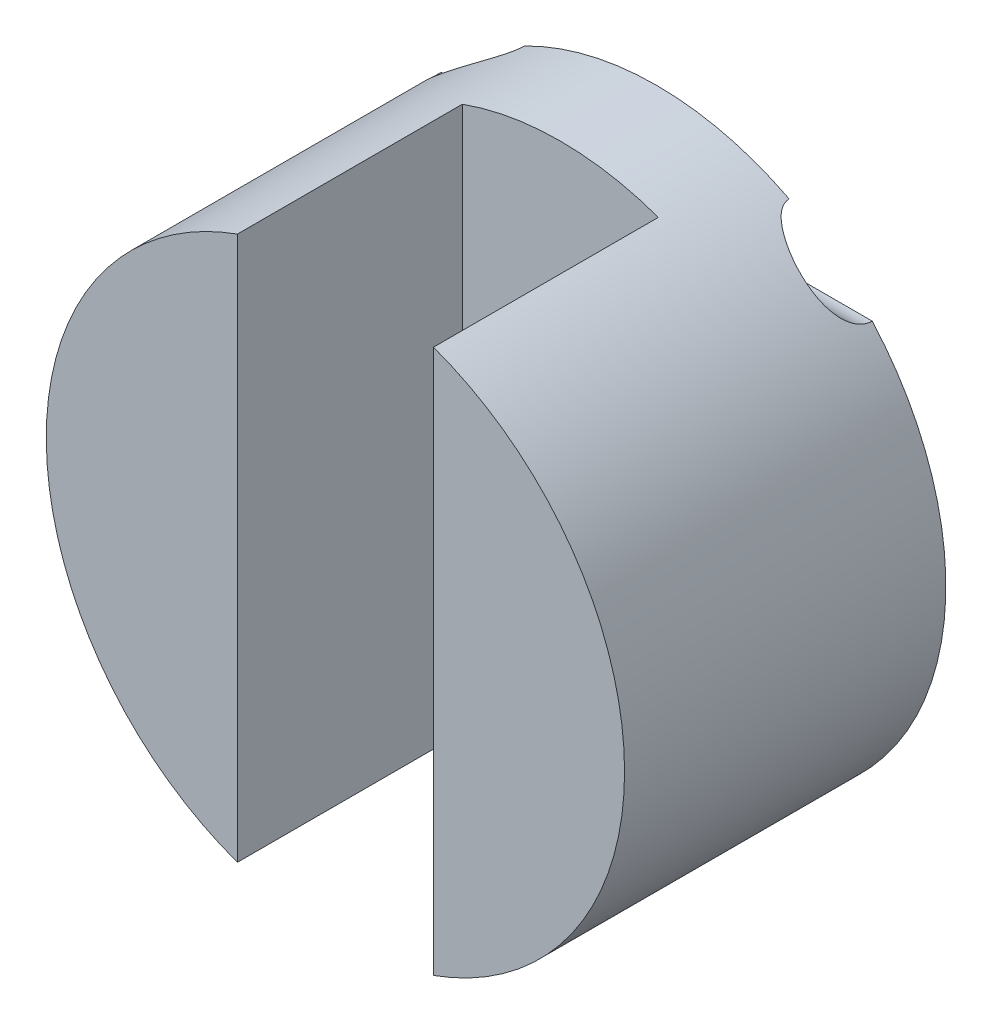
from build123d import *

# Parameters (mm, degrees)
SKETCH1_R               = 90
BOSS_EXTRUDE1_DEPTH     = 100
CUT_EXTRUDE1_DEPTH      = 200
CUT_EXTRUDE1_DEPTH_BACK = 200
SKETCH2_W               = 61
SKETCH2_H               = 70
CUT_EXTRUDE2_DEPTH      = 200
CUT_EXTRUDE2_DEPTH_BACK = 200
SKETCH3_R               = 10


with BuildPart() as part:
    # Sketch1 → Boss-Extrude1 (new body)
    with BuildSketch(Plane.XY):
        Circle(SKETCH1_R)
    extrude(amount=BOSS_EXTRUDE1_DEPTH)

    # Sketch2 → Cut-Extrude1 (cut, two sides: drawn at the far end of the back side and taken through both)
    with BuildSketch(Plane(origin=(0, 0, 0), x_dir=(1, 0, 0), z_dir=(0, 1, 0)).offset(-CUT_EXTRUDE1_DEPTH_BACK)):
        with Locations((0, -65)):
            Rectangle(SKETCH2_W, SKETCH2_H)
    extrude(amount=CUT_EXTRUDE1_DEPTH + CUT_EXTRUDE1_DEPTH_BACK, mode=Mode.SUBTRACT)

    # Sketch3 → Cut-Extrude2 (cut, two sides: drawn at the far end of the back side and taken through both)
    with BuildSketch(Plane(origin=(0, 0, 0), x_dir=(0, 0, -1), z_dir=(1, 0, 0)).offset(-CUT_EXTRUDE2_DEPTH_BACK)):
        with Locations((0, 70)):
            Circle(SKETCH3_R)
    extrude(amount=CUT_EXTRUDE2_DEPTH + CUT_EXTRUDE2_DEPTH_BACK, mode=Mode.SUBTRACT)


solid = part.part
